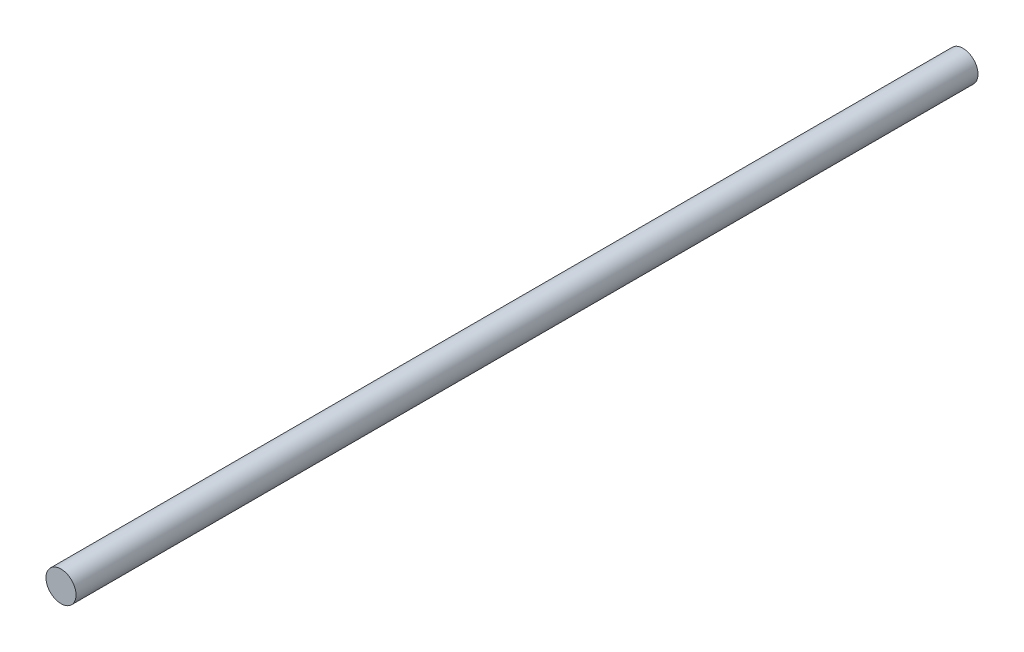
from build123d import *

# Parameters (mm, degrees)
SKETCH_1_R      = 0.5
EXTRUDE_1_DEPTH = 30


with BuildPart() as part:
    # 草图1 → 凸台-拉伸1 (new body)
    with BuildSketch(Plane.XY):
        Circle(SKETCH_1_R)
    extrude(amount=EXTRUDE_1_DEPTH)


solid = part.part
